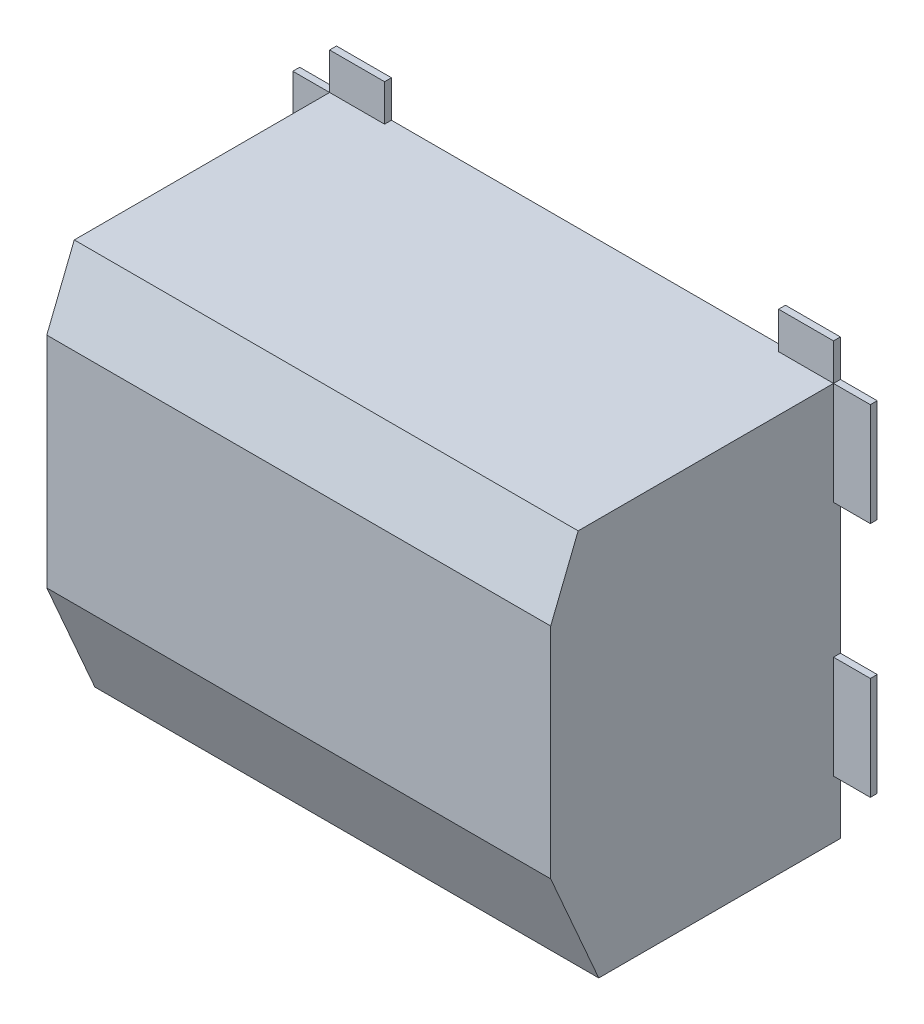
from build123d import *

# Parameters (mm, degrees)
SKETCH1_W           = 465.838
SKETCH1_H           = 367.518
BOSS_EXTRUDE1_DEPTH = 3.175
SKETCH2_W           = 3.175
SKETCH2_H           = 308.082
SKETCH2_W_2         = 87.632
SKETCH2_W_3         = 89.789
SKETCH2_W_4         = 459.488
SKETCH2_H_2         = 50.8
BOSS_EXTRUDE2_DEPTH = 200.6
SKETCH11_W          = 87.632
SKETCH11_H          = 308.082
SKETCH11_W_2        = 89.789
SKETCH11_W_3        = 3.175
SKETCH11_W_4        = 459.488
SKETCH11_H_2        = 50.8
SKETCH11_H_3        = 3.175
BOSS_EXTRUDE8_DEPTH = 64.05
SKETCH10_W          = 34.036
SKETCH10_H          = 95.25
SKETCH10_W_2        = 50.8
SKETCH10_H_2        = 34.036
BOSS_EXTRUDE7_DEPTH = 6.35
CUT_EXTRUDE1_DEPTH  = 605.839795074


with BuildPart() as part:
    # Sketch1 → Boss-Extrude1 (new body)
    with BuildSketch(Plane.XY):
        with Locations((-46.4825, -26.543)):
            Rectangle(SKETCH1_W, SKETCH1_H)
    extrude(amount=BOSS_EXTRUDE1_DEPTH)

    # Sketch2 → Boss-Extrude2 (add)
    with BuildSketch(Plane.XY.offset(3.175)):
        Polygon((186.4365, -210.302), (186.4365, -157.216), (183.2615, -157.216), (183.2615, -208.016), (-276.2265, -208.016), (-276.2265, -157.216), (-279.4015, -157.216), (-279.4015, -210.302), align=None)
        Polygon((183.2615, 154.041), (186.4365, 154.041), (186.4365, 157.216), (-279.4015, 157.216), (-279.4015, -157.216), (-276.2265, -157.216), (183.2615, -157.216), (186.4365, -157.216), (186.4365, -154.041), (183.2615, -154.041), (93.4725, -154.041), (90.2975, -154.041), (0.5085, -154.041), (-2.6665, -154.041), (-92.4555, -154.041), (-95.6305, -154.041), (-185.4195, -154.041), (-188.5945, -154.041), (-276.2265, -154.041), (-276.2265, 154.041), (-188.5945, 154.041), (-185.4195, 154.041), (-95.6305, 154.041), (-92.4555, 154.041), (-2.6665, 154.041), (0.5085, 154.041), (90.2975, 154.041), (93.4725, 154.041), align=None)
        with Locations((184.849, 0)):
            Rectangle(SKETCH2_W, SKETCH2_H)
        with Locations((91.885, 0)):
            Rectangle(SKETCH2_W, SKETCH2_H)
        with Locations((-187.007, 0)):
            Rectangle(SKETCH2_W, SKETCH2_H)
        with Locations((-94.043, 0)):
            Rectangle(SKETCH2_W, SKETCH2_H)
        with Locations((-1.079, 0)):
            Rectangle(SKETCH2_W, SKETCH2_H)
        with Locations((-232.4105, 0)):
            Rectangle(SKETCH2_W_2, SKETCH2_H)
        with Locations((-140.525, 0)):
            Rectangle(SKETCH2_W_3, SKETCH2_H)
        with Locations((-47.561, 0)):
            Rectangle(SKETCH2_W_3, SKETCH2_H)
        with Locations((45.403, 0)):
            Rectangle(SKETCH2_W_3, SKETCH2_H)
        with Locations((138.367, 0)):
            Rectangle(SKETCH2_W_3, SKETCH2_H)
        with Locations((-46.4825, -182.616)):
            Rectangle(SKETCH2_W_4, SKETCH2_H_2)
    extrude(amount=BOSS_EXTRUDE2_DEPTH)

    # Sketch11 → Boss-Extrude8 (add)
    with BuildSketch(Plane.XY.offset(203.775)):
        with Locations((-232.4105, 0)):
            Rectangle(SKETCH11_W, SKETCH11_H)
        with Locations((-140.525, 0)):
            Rectangle(SKETCH11_W_2, SKETCH11_H)
        with Locations((-187.007, 0)):
            Rectangle(SKETCH11_W_3, SKETCH11_H)
        Polygon((-276.2265, -157.216), (183.2615, -157.216), (183.2615, -154.041), (93.4725, -154.041), (90.2975, -154.041), (0.5085, -154.041), (-2.6665, -154.041), (-92.4555, -154.041), (-95.6305, -154.041), (-185.4195, -154.041), (-188.5945, -154.041), (-276.2265, -154.041), align=None)
        with Locations((-46.4825, -182.616)):
            Rectangle(SKETCH11_W_4, SKETCH11_H_2)
        with Locations((-47.561, 0)):
            Rectangle(SKETCH11_W_2, SKETCH11_H)
        with Locations((-94.043, 0)):
            Rectangle(SKETCH11_W_3, SKETCH11_H)
        with Locations((45.403, 0)):
            Rectangle(SKETCH11_W_2, SKETCH11_H)
        with Locations((-1.079, 0)):
            Rectangle(SKETCH11_W_3, SKETCH11_H)
        with Locations((138.367, 0)):
            Rectangle(SKETCH11_W_2, SKETCH11_H)
        with Locations((91.885, 0)):
            Rectangle(SKETCH11_W_3, SKETCH11_H)
        with Locations((184.849, 0)):
            Rectangle(SKETCH11_W_3, SKETCH11_H)
        with Locations((184.849, -155.6285)):
            Rectangle(SKETCH11_W_3, SKETCH11_H_3)
        Polygon((-279.4015, -210.302), (186.4365, -210.302), (186.4365, -157.216), (183.2615, -157.216), (183.2615, -208.016), (-276.2265, -208.016), (-276.2265, -157.216), (-279.4015, -157.216), align=None)
        Polygon((-279.4015, 157.216), (-279.4015, -157.216), (-276.2265, -157.216), (-276.2265, -154.041), (-276.2265, 154.041), (-188.5945, 154.041), (-185.4195, 154.041), (-95.6305, 154.041), (-92.4555, 154.041), (-2.6665, 154.041), (0.5085, 154.041), (90.2975, 154.041), (93.4725, 154.041), (183.2615, 154.041), (186.4365, 154.041), (186.4365, 157.216), align=None)
    extrude(amount=BOSS_EXTRUDE8_DEPTH)

    # Sketch10 → Boss-Extrude7 (add)
    with BuildSketch(Plane.XY):
        with Locations((203.4545, 109.591)):
            Rectangle(SKETCH10_W, SKETCH10_H)
        with Locations((203.4545, -109.591)):
            Rectangle(SKETCH10_W, SKETCH10_H)
        with Locations((161.0365, 174.234)):
            Rectangle(SKETCH10_W_2, SKETCH10_H_2)
    boss_extrude7 = extrude(amount=BOSS_EXTRUDE7_DEPTH)

    # Mirror1: Boss-Extrude7 across plane
    add(boss_extrude7.mirror(Plane.ZY.offset(46.4825)))

    # Sketch12 → Cut-Extrude1 (cut, through all)
    with BuildSketch(Plane(origin=(186.4365, 0, 0), x_dir=(0, 0, -1), z_dir=(1, 0, 0))):
        Polygon((-267.825, -210.302), (-223.375, -210.302), (-267.825, -108.702), align=None)
        Polygon((-267.825, 157.216), (-267.825, 93.716), (-242.425, 157.216), align=None)
    extrude(amount=-CUT_EXTRUDE1_DEPTH, mode=Mode.SUBTRACT)


solid = part.part
